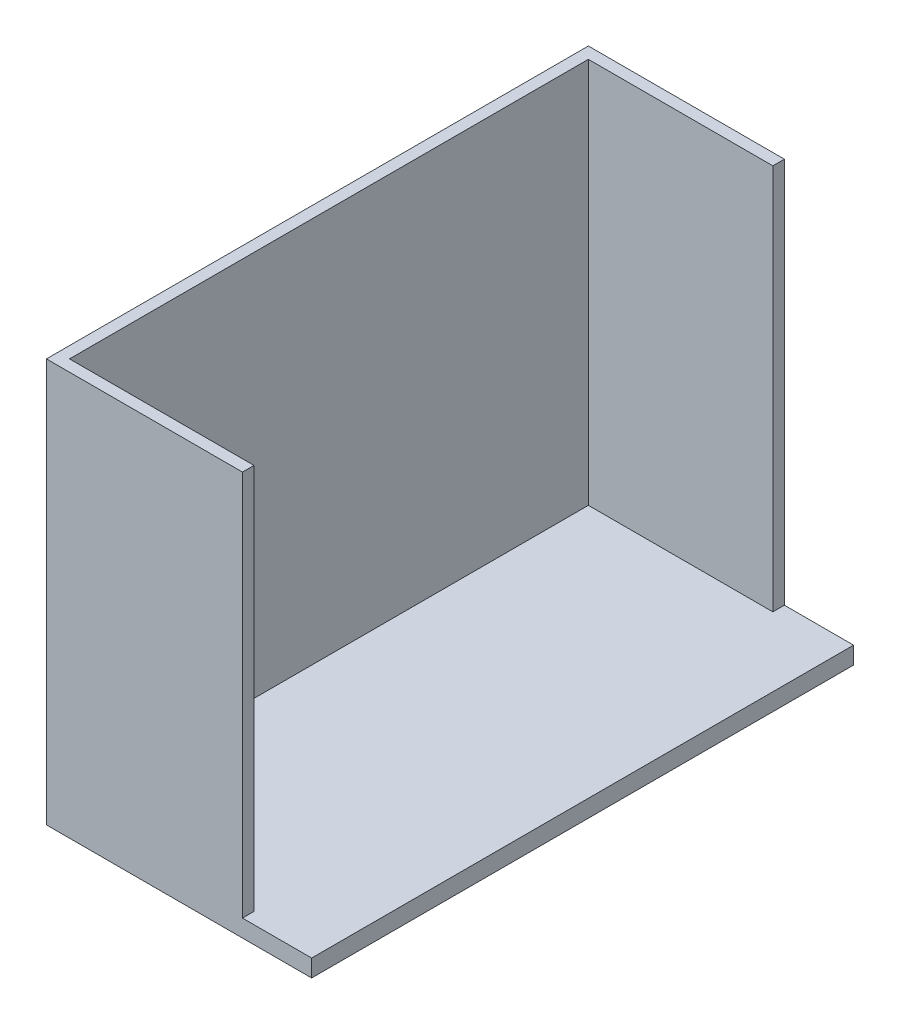
from build123d import *

# Parameters (mm, degrees)
SKETCH1_W           = 292.1
SKETCH1_H           = 596.9
BOSS_EXTRUDE1_DEPTH = 19.05
BOSS_EXTRUDE2_DEPTH = 425.45


with BuildPart() as part:
    # Sketch1 → Boss-Extrude1 (new body)
    with BuildSketch(Plane(origin=(0, 0, 0), x_dir=(1, 0, 0), z_dir=(0, 1, 0))):
        Rectangle(SKETCH1_W, SKETCH1_H)
    extrude(amount=BOSS_EXTRUDE1_DEPTH)

    # Sketch2 → Boss-Extrude2 (add)
    with BuildSketch(Plane(origin=(0, 19.05, 0), x_dir=(1, 0, 0), z_dir=(0, 1, 0))):
        Polygon((-146.05, -298.45), (-146.05, 298.45), (69.85, 298.45), (69.85, 285.75), (-133.35, 285.75), (-133.35, -285.75), (69.85, -285.75), (69.85, -298.45), align=None)
    extrude(amount=BOSS_EXTRUDE2_DEPTH)


solid = part.part
